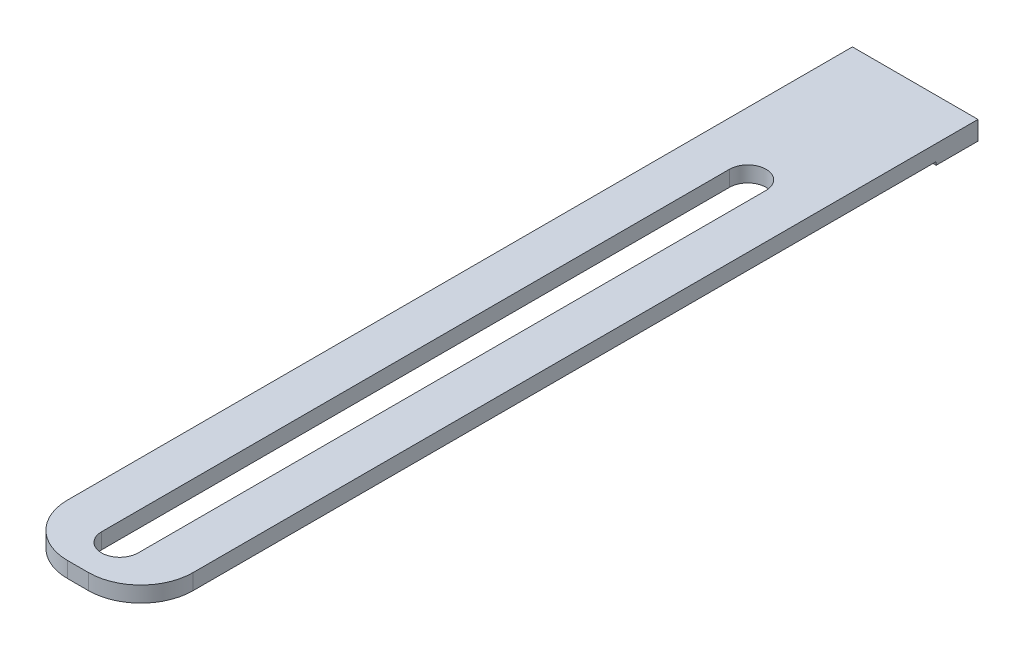
from build123d import *

# Parameters (mm, degrees)
EXTRUDE_1_DEPTH = 1.5
SKETCH_2_W      = 12
SKETCH_2_H      = 4
EXTRUDE_2_DEPTH = 0.3


with BuildPart() as part:
    # 草图1 → 凸台-拉伸1 (new body)
    with BuildSketch(Plane(origin=(0, 0, 0), x_dir=(1, 0, 0), z_dir=(0, 1, 0))):
        with BuildLine():
            Line((-6, 40), (6, 40))
            Line((6, 40), (6, -35))
            ThreePointArc((6, -35), (4.535533906, -38.535533906), (1, -40))
            Line((1, -40), (-1, -40))
            ThreePointArc((-1, -40), (-4.535533906, -38.535533906), (-6, -35))
            Line((-6, -35), (-6, 40))
        make_face()
        with BuildLine():
            Line((-1.75, -36), (-1.75, 24))
            ThreePointArc((-1.75, 24), (0, 25.75), (1.75, 24))
            Line((1.75, 24), (1.75, -36))
            ThreePointArc((1.75, -36), (0, -37.75), (-1.75, -36))
        make_face(mode=Mode.SUBTRACT)
    extrude(amount=EXTRUDE_1_DEPTH)

    # 草图2 → 凸台-拉伸2 (add)
    with BuildSketch(Plane.XZ):
        with Locations((0, -38)):
            Rectangle(SKETCH_2_W, SKETCH_2_H)
    extrude(amount=EXTRUDE_2_DEPTH)


solid = part.part
